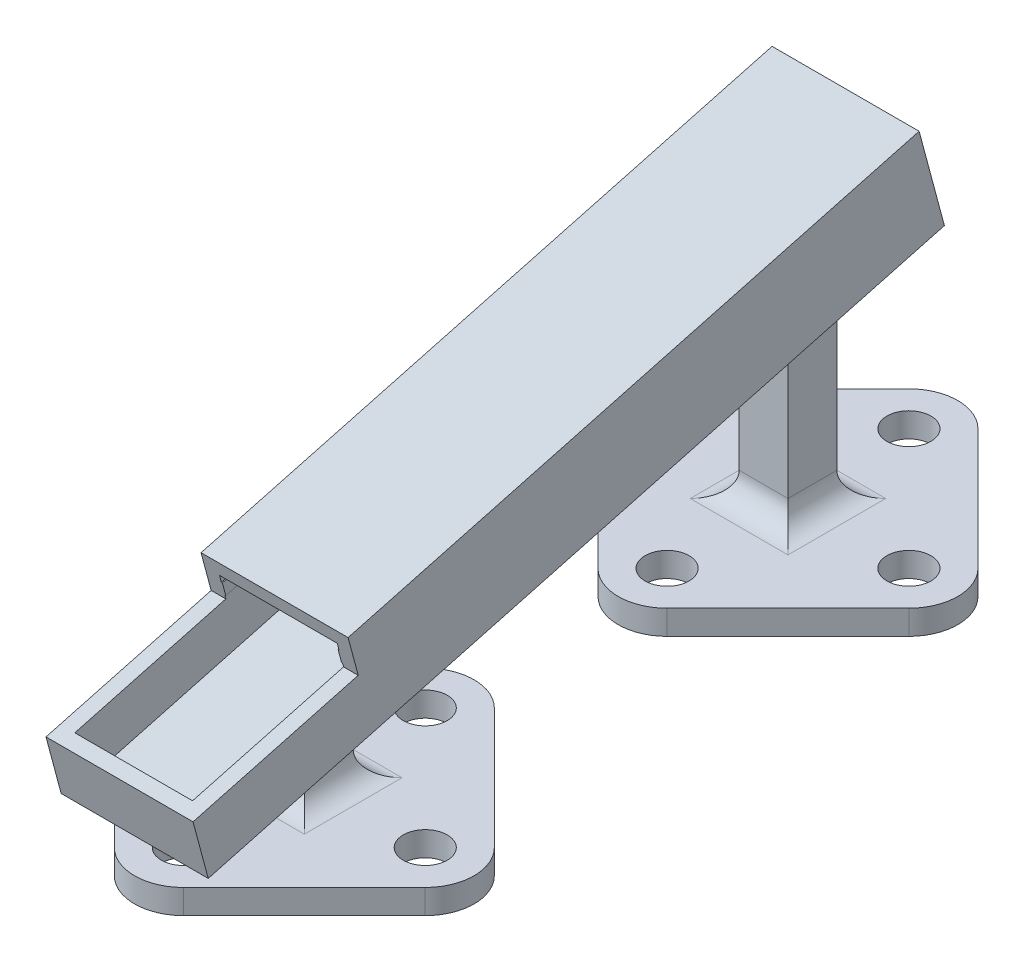
from build123d import *

# Parameters (mm, degrees)
SKETCH1_R                = 4.5
BOSS_EXTRUDE1_DEPTH      = 2.5
SKETCH2_W                = 10
SKETCH2_H                = 45
BOSS_EXTRUDE2_DEPTH      = 5
CUT_EXTRUDE1_DEPTH       = 147.126229678
CUT_EXTRUDE1_DEPTH_BACK  = 147.126229678
BOSS_EXTRUDE3_DEPTH      = 12.05
FILLET1_R                = 5
FILLET2_R                = 5
BOSS_EXTRUDE4_DEPTH      = 10
BOSS_EXTRUDE4_DEPTH_BACK = 2.000004
SKETCH6_W                = 30.1
SKETCH6_H                = 156
SKETCH6_W_2              = 24.1
SKETCH6_H_2              = 150
BOSS_EXTRUDE5_DEPTH      = 5
SKETCH8_W                = 30.1
SKETCH8_H                = 121
BOSS_EXTRUDE6_DEPTH      = 3
CUT_EXTRUDE2_REACH       = 179.268
SKETCH10_W               = 24.1
SKETCH10_H               = 15
SKETCH11_W               = 0.2
SKETCH11_H               = 2.7
BOSS_EXTRUDE7_DEPTH      = 121


with BuildPart() as part:
    # Sketch1 → Boss-Extrude1 (new, symmetric)
    with BuildSketch(Plane(origin=(0, 0, 0), x_dir=(1, 0, 0), z_dir=(0, 1, 0))):
        with BuildLine():
            Line((-31.821067812, 7.071067812), (-7.071067812, 31.821067812))
            ThreePointArc((-7.071067812, 31.821067812), (0, 34.75), (7.071067812, 31.821067812))
            Line((7.071067812, 31.821067812), (31.821067812, 7.071067812))
            ThreePointArc((31.821067812, 7.071067812), (34.75, 0), (31.821067812, -7.071067812))
            Line((31.821067812, -7.071067812), (7.071067812, -31.821067812))
            ThreePointArc((7.071067812, -31.821067812), (0, -34.75), (-7.071067812, -31.821067812))
            Line((-7.071067812, -31.821067812), (-31.821067812, -7.071067812))
            ThreePointArc((-31.821067812, -7.071067812), (-34.75, 0), (-31.821067812, 7.071067812))
        make_face()
        with Locations(Location((0, 24.75, 0), (0, 0, 270))):
            Circle(SKETCH1_R, mode=Mode.SUBTRACT)
        with Locations(Location((24.75, 0, 0), (0, 0, 270))):
            Circle(SKETCH1_R, mode=Mode.SUBTRACT)
        with Locations(Location((0, -24.75, 0), (0, 0, 270))):
            Circle(SKETCH1_R, mode=Mode.SUBTRACT)
        with Locations(Location((-24.75, 0, 0), (0, 0, 270))):
            Circle(SKETCH1_R, mode=Mode.SUBTRACT)
    extrude(amount=BOSS_EXTRUDE1_DEPTH, both=True)


with BuildPart() as body_2:
    # Mirror3: mirrored copy
    add(part.part.mirror(Plane.XY.offset(49.5)))


with BuildPart() as body_3:
    # Sketch2 → Boss-Extrude2 (new, symmetric)
    with BuildSketch(Plane(origin=(0, 0, 0), x_dir=(0, 0, -1), z_dir=(1, 0, 0))):
        with Locations((-99, 25)):
            Rectangle(SKETCH2_W, SKETCH2_H)
    extrude(amount=BOSS_EXTRUDE2_DEPTH, both=True)


with BuildPart() as body_4:
    # Mirror5: mirrored copy
    add(body_3.part.mirror(Plane.XY.offset(49.5)))


with BuildPart() as cut_extrude1_tool:
    # Sketch3 → Cut-Extrude1 (new, two sides: drawn at the far end of the back side and taken through both)
    with BuildSketch(Plane(origin=(0, 0, 0), x_dir=(0, 0, -1), z_dir=(1, 0, 0)).offset(-CUT_EXTRUDE1_DEPTH_BACK)):
        Polygon((-398.060619113, -61.293305417), (-104, 17.5), (5, 46.706461975), (299.060619113, 125.499767392), (141.474008279, 713.621005618), (-555.647229947, 526.827932809), align=None)
    extrude(amount=CUT_EXTRUDE1_DEPTH + CUT_EXTRUDE1_DEPTH_BACK)


with BuildPart() as body_3_1:
    add(body_3.part)

    # Cut-Extrude1: cut by cut_extrude1_tool
    add(cut_extrude1_tool.part, mode=Mode.SUBTRACT)


with BuildPart() as body_4_1:
    add(body_4.part)

    # Cut-Extrude1: cut by cut_extrude1_tool
    add(cut_extrude1_tool.part, mode=Mode.SUBTRACT)

    # Combine2: union part
    add(part.part)

    # Fillet2
    fillet2_edges = [body_4_1.edges().sort_by_distance(p)[0] for p in [
        (-5, 2.5, 0),
        (0, 2.5, 5),
        (0, 2.5, -5),
        (5, 2.5, 0),
    ]]
    fillet(fillet2_edges, radius=FILLET2_R)


with BuildPart() as body_5:
    # Sketch4 → Boss-Extrude3 (new, symmetric)
    with BuildSketch(Plane(origin=(0, 0, 0), x_dir=(0, 0, -1), z_dir=(1, 0, 0))):
        Polygon((-130.821067812, 10.31331654), (14.067806131, 49.136173305), (13.550168041, 51.068024958), (-131.338705902, 12.245168192), align=None)
    extrude(amount=BOSS_EXTRUDE3_DEPTH, both=True)



with BuildPart() as body_2_1:
    add(body_2.part)

    # Combine1: union body 3
    add(body_3_1.part)

    # Fillet1
    fillet1_edges = [body_2_1.edges().sort_by_distance(p)[0] for p in [
        (0, 2.5, 94),
        (5, 2.5, 99),
        (-5, 2.5, 99),
        (0, 2.5, 104),
    ]]
    fillet(fillet1_edges, radius=FILLET1_R)


with BuildPart() as body_5_1:
    add(body_5.part)

    add(body_2_1.part)  # Boss-Extrude4 merges body 2

    add(body_4_1.part)  # Boss-Extrude4 merges body 4
    # Sketch6 → Boss-Extrude4 (add, two sides: drawn at the far end of the back side and taken through both)
    with BuildSketch(Plane(origin=(0, 44.259573936, 11.859317093), x_dir=(1, 0, 0), z_dir=(0, 0.96592582628907, 0.2588190451025143)).offset(-BOSS_EXTRUDE4_DEPTH_BACK)):
        with Locations((0, -48.694165284)):
            Rectangle(SKETCH6_W, SKETCH6_H)
        with Locations((0, -48.694165284)):
            Rectangle(SKETCH6_W_2, SKETCH6_H_2, mode=Mode.SUBTRACT)
    extrude(amount=BOSS_EXTRUDE4_DEPTH + BOSS_EXTRUDE4_DEPTH_BACK)

    # Sketch7 → Boss-Extrude5 (add)
    with BuildSketch(Plane(origin=(0, 53.918832199, 14.447507544), x_dir=(1, 0, 0), z_dir=(0, 0.96592582628907, 0.25881904510251436))):
        Polygon((12.05, 26.305834716), (12.05, -91.694165284), (15.05, -91.694165284), (15.05, 29.305834716), (-15.05, 29.305834716), (-15.05, -91.694165284), (-12.05, -91.694165284), (-12.05, 26.305834716), align=None)
    extrude(amount=BOSS_EXTRUDE5_DEPTH)

    # Sketch8 → Boss-Extrude6 (add)
    with BuildSketch(Plane(origin=(0, 58.74846133, 15.74160277), x_dir=(1, 0, 0), z_dir=(0, 0.96592582628907, 0.25881904510251436))):
        with Locations((0, -31.194165284)):
            Rectangle(SKETCH8_W, SKETCH8_H)
    extrude(amount=BOSS_EXTRUDE6_DEPTH)

    # Sketch10 → Cut-Extrude2 (cut, up to next)
    with BuildSketch(Plane(origin=(0, 6.808451022, -25.409485135), x_dir=(1, 0, 0), z_dir=(0, -0.2588190451025143, 0.96592582628907)), mode=Mode.PRIVATE) as cut_extrude2_sk1:
        with Locations((0, 53.320882651)):
            Rectangle(SKETCH10_W, SKETCH10_H)
    cut_extrude2_tool1 = extrude(cut_extrude2_sk1.sketch, amount=-CUT_EXTRUDE2_REACH, mode=Mode.PRIVATE) & body_5_1.part
    add(cut_extrude2_tool1.solids().sort_by_distance((0, 58.312469, -11.609025))[0], mode=Mode.SUBTRACT)

    # Sketch11 → Boss-Extrude7 (add)
    with BuildSketch(Plane(origin=(0, 7.584908157, -28.307262614), x_dir=(-1, 0, 0), z_dir=(0, 0.2588190451025143, -0.96592582628907))):
        with Locations((-11.95, 57.970882651)):
            Rectangle(SKETCH11_W, SKETCH11_H)
        with Locations((11.95, 57.970882651)):
            Rectangle(SKETCH11_W, SKETCH11_H)
    extrude(amount=-BOSS_EXTRUDE7_DEPTH)


solid = body_5_1.part
